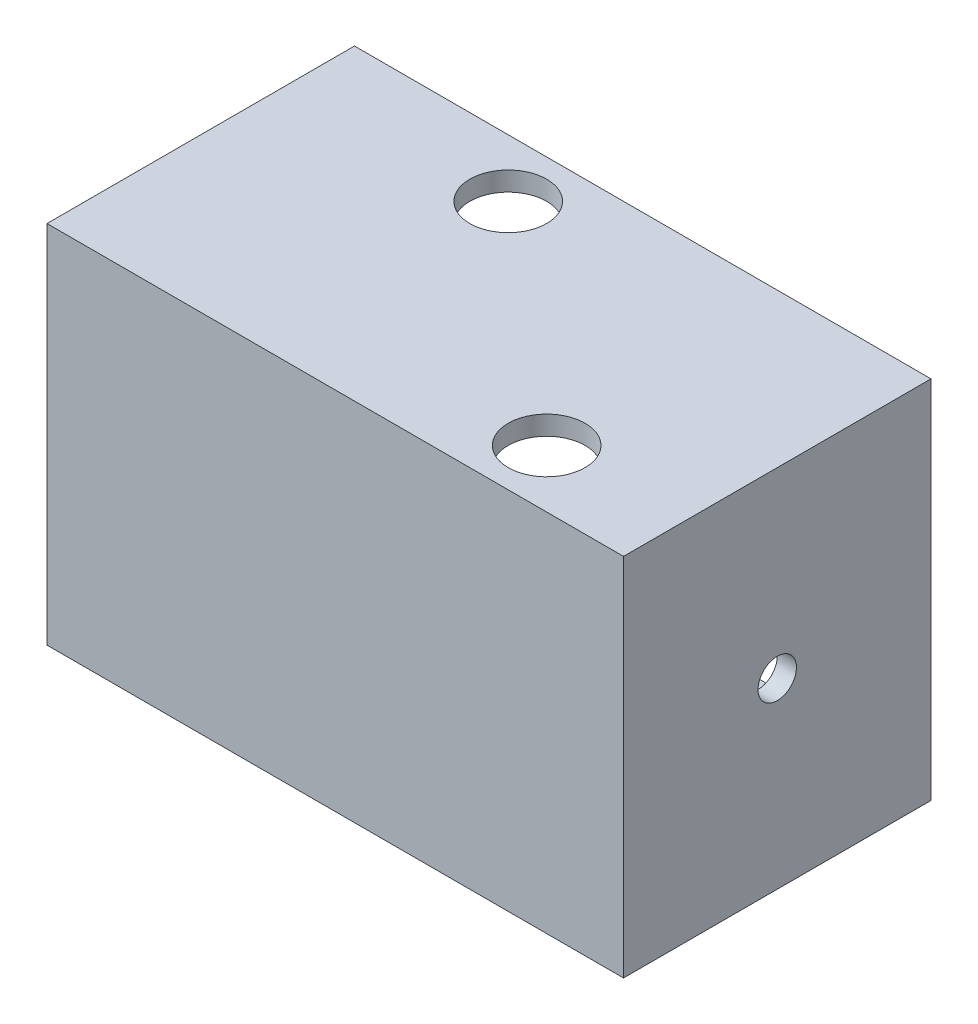
from build123d import *

# Parameters (mm, degrees)
ESQUISSE1_W             = 30
ESQUISSE1_H             = 19
BOSS_EXTRU_1_DEPTH      = 16
ESQUISSE2_R             = 3
ENL_V_MAT_EXTRU_2_DEPTH = 29
ESQUISSE3_R             = 1
ENL_V_MAT_EXTRU_3_DEPTH = 8
ESQUISSE7_W             = 28
ESQUISSE7_H             = 17
ENL_V_MAT_EXTRU_4_DEPTH = 15
ESQUISSE8_R             = 2
ENL_V_MAT_EXTRU_7_DEPTH = 1.5


with BuildPart() as part:
    # Esquisse1 → Boss.-Extru.1 (new body)
    with BuildSketch(Plane.XY):
        with Locations((15, 9.5)):
            Rectangle(ESQUISSE1_W, ESQUISSE1_H)
    extrude(amount=BOSS_EXTRU_1_DEPTH)

    # Esquisse2 → Enlèv. mat.-Extru.2 (cut)
    with BuildSketch(Plane.ZY):
        with Locations((8, 9.5)):
            Circle(ESQUISSE2_R)
    extrude(amount=-ENL_V_MAT_EXTRU_2_DEPTH, mode=Mode.SUBTRACT)

    # Esquisse3 → Enlèv. mat.-Extru.3 (cut)
    with BuildSketch(Plane(origin=(30, 0, 0), x_dir=(0, 0, -1), z_dir=(1, 0, 0))):
        with Locations((-8, 9.5)):
            Circle(ESQUISSE3_R)
    extrude(amount=-ENL_V_MAT_EXTRU_3_DEPTH, mode=Mode.SUBTRACT)

    # Esquisse7 → Enlèv. mat.-Extru.4 (cut)
    with BuildSketch(Plane(origin=(0, 0, 0), x_dir=(-1, 0, 0), z_dir=(0, 0, -1))):
        with Locations((-15, 9.5)):
            Rectangle(ESQUISSE7_W, ESQUISSE7_H)
    extrude(amount=-ENL_V_MAT_EXTRU_4_DEPTH, mode=Mode.SUBTRACT)

    # Esquisse8 → Enlèv. mat.-Extru.7 (cut)
    with BuildSketch(Plane(origin=(0, 19, 0), x_dir=(1, 0, 0), z_dir=(0, 1, 0))):
        with Locations(Location((23, -13, 0), (0, 0, 270))):
            Circle(ESQUISSE8_R)
        with Locations(Location((11, -3, 0), (0, 0, 270))):
            Circle(ESQUISSE8_R)
    extrude(amount=-ENL_V_MAT_EXTRU_7_DEPTH, mode=Mode.SUBTRACT)


solid = part.part
